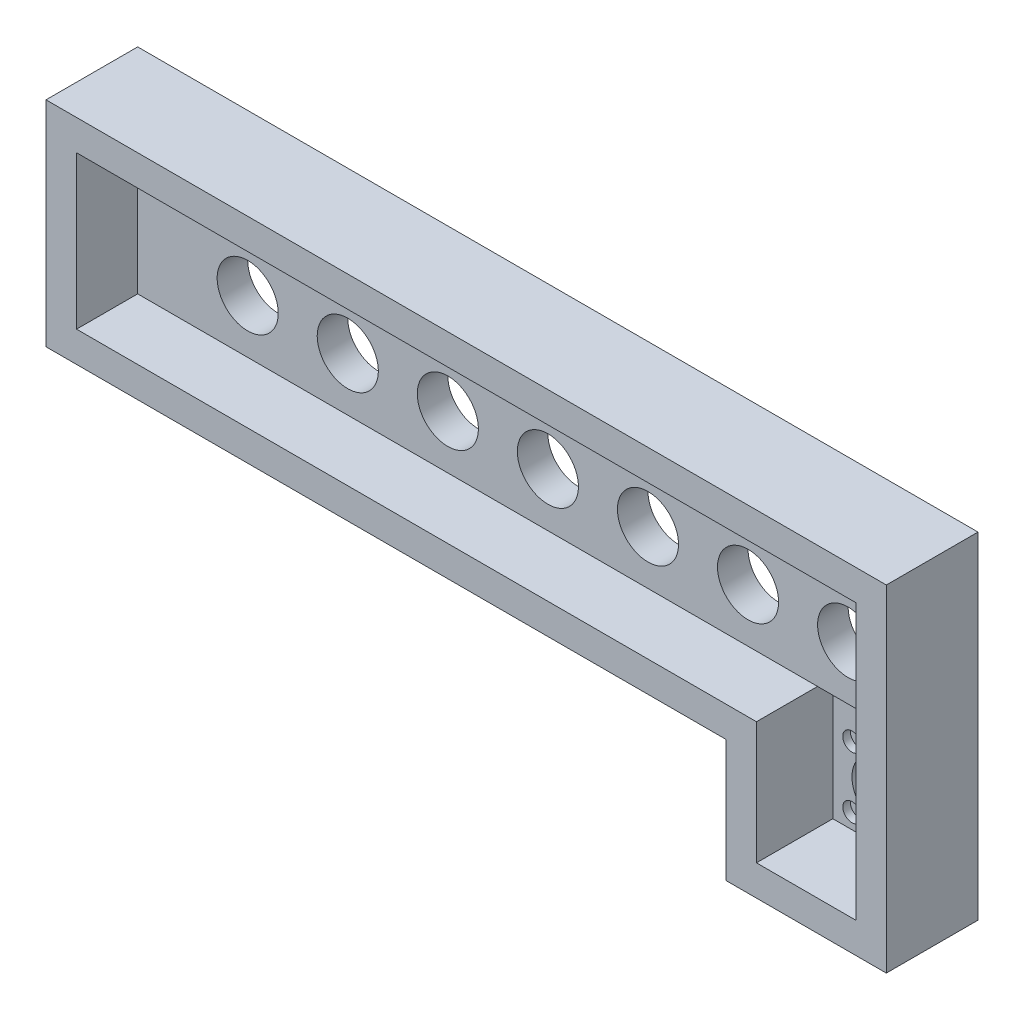
from build123d import *

# Parameters (mm, degrees)
BOSS_EXTRUDE1_DEPTH = 6
SHELL1_T            = -2
SKETCH3_R           = 2
CUT_EXTRUDE1_DEPTH  = 32.894356868
SKETCH9_R           = 1.5
CUT_EXTRUDE6_DEPTH  = 32.894356868
SKETCH11_R          = 2
CUT_EXTRUDE7_DEPTH  = 32.579265349
SKETCH12_W          = 6.5
SKETCH12_H          = 8
CUT_EXTRUDE8_DEPTH  = 1
SKETCH13_R          = 0.6
CUT_EXTRUDE9_DEPTH  = 0.5


with BuildPart() as part:
    # Sketch1 → Boss-Extrude1 (new body)
    with BuildSketch(Plane.XY):
        Polygon((17, -7), (-27.5, -7), (-27.5, 7), (27.5, 7), (27.5, -7), (27.5, -15), (17, -15), align=None)
    extrude(amount=BOSS_EXTRUDE1_DEPTH)

    # Shell1
    shell1_openings = [part.faces().sort_by_distance(p)[0] for p in [
        (2.18852459, -1.081967213, 6),
    ]]
    offset(amount=SHELL1_T, openings=shell1_openings, kind=Kind.INTERSECTION)

    # Sketch3 → Cut-Extrude1 (cut, through all)
    with BuildSketch(Plane(origin=(0, 0, 0), x_dir=(-1, 0, 0), z_dir=(0, 0, -1))):
        with Locations((-21, -1.5)):
            Circle(SKETCH3_R)
        with Locations((-14.45, -1.5)):
            Circle(SKETCH3_R)
        with Locations((-7.9, -1.5)):
            Circle(SKETCH3_R)
        with Locations((-1.35, -1.5)):
            Circle(SKETCH3_R)
        with Locations((5.2, -1.5)):
            Circle(SKETCH3_R)
        with Locations((11.75, -1.5)):
            Circle(SKETCH3_R)
        with Locations((18.3, -1.5)):
            Circle(SKETCH3_R)
    extrude(amount=-CUT_EXTRUDE1_DEPTH, mode=Mode.SUBTRACT)

    # Sketch9 → Cut-Extrude6 (cut, through all)
    with BuildSketch(Plane(origin=(0, 0, 0), x_dir=(-1, 0, 0), z_dir=(0, 0, -1))):
        with Locations((-17.5, 2.8)):
            Circle(SKETCH9_R)
        with Locations((8.5, 2.8)):
            Circle(SKETCH9_R)
    extrude(amount=-CUT_EXTRUDE6_DEPTH, mode=Mode.SUBTRACT)

    # Sketch11 → Cut-Extrude7 (cut, through all)
    with BuildSketch(Plane.XY.offset(2)):
        with Locations((22.25, -10)):
            Circle(SKETCH11_R)
    extrude(amount=-CUT_EXTRUDE7_DEPTH, mode=Mode.SUBTRACT)

    # Sketch12 → Cut-Extrude8 (cut)
    with BuildSketch(Plane.XY.offset(2)):
        with Locations((22.25, -9)):
            Rectangle(SKETCH12_W, SKETCH12_H)
    extrude(amount=-CUT_EXTRUDE8_DEPTH, mode=Mode.SUBTRACT)

    # Sketch13 → Cut-Extrude9 (cut)
    with BuildSketch(Plane.XY.offset(1)):
        with Locations((20.25, -8)):
            Circle(SKETCH13_R)
        with Locations((24.25, -8)):
            Circle(SKETCH13_R)
        with Locations((24.25, -12)):
            Circle(SKETCH13_R)
        with Locations((20.25, -12)):
            Circle(SKETCH13_R)
    extrude(amount=-CUT_EXTRUDE9_DEPTH, mode=Mode.SUBTRACT)


solid = part.part
